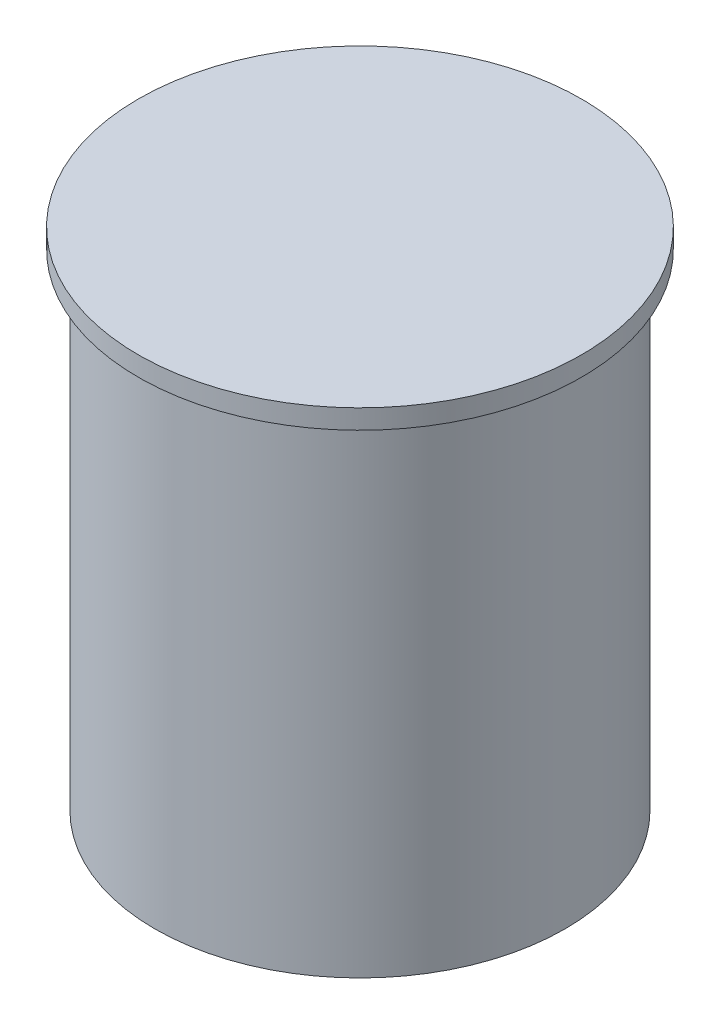
from build123d import *


with BuildPart() as part:
    # Sketch1 → Revolve1 (revolve)
    with BuildSketch(Plane.XY, mode=Mode.PRIVATE) as revolve1_sk:
        Polygon((0, 0), (28.956, 0), (28.956, -2.54), (26.797, -2.54), (26.797, -66.04), (0, -66.04), (0, -63.5), (24.257, -63.5), (24.257, -2.54), (0, -2.54), align=None)
    revolve(revolve1_sk.sketch.rotate(Axis((0, 0, 0), (0, -1, 0)), 180), axis=Axis((0, 0, 0), (0, -1, 0)))


solid = part.part
